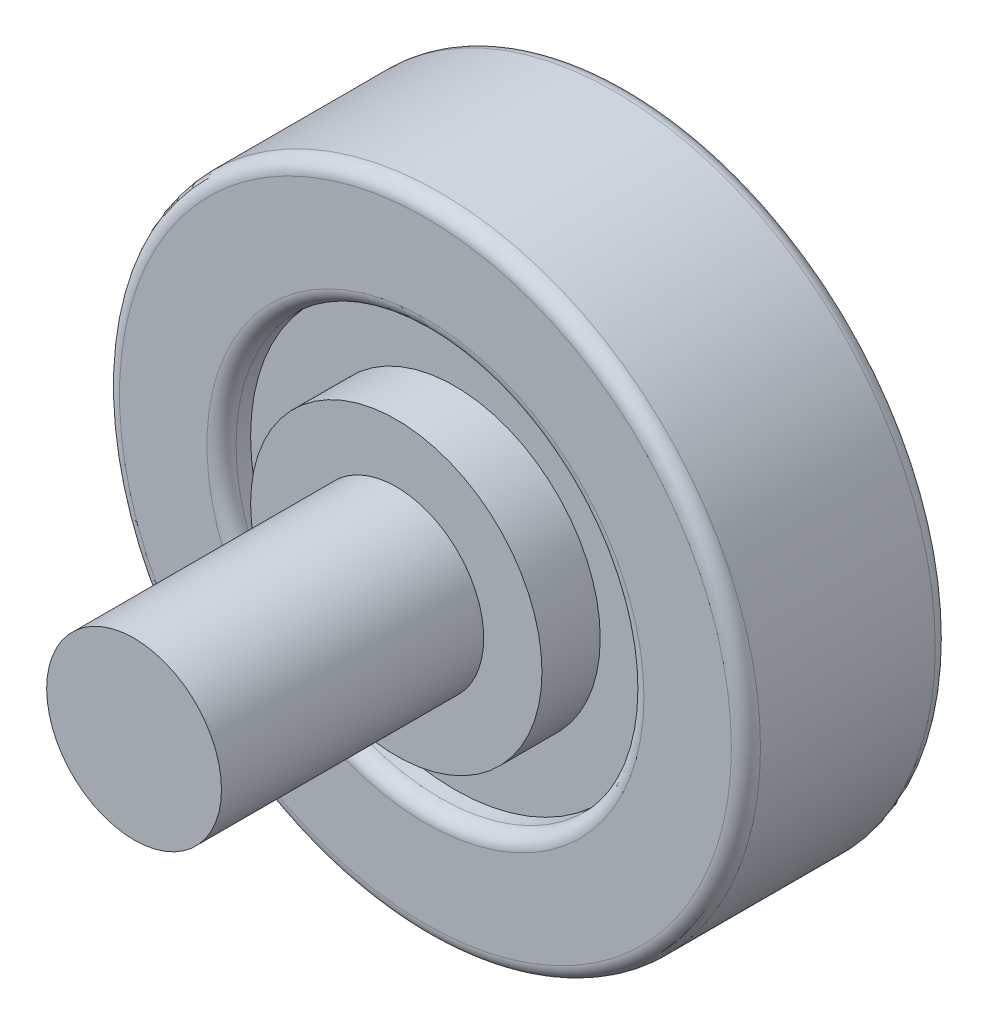
from build123d import *

# Parameters (mm, degrees)
SKETCH_1_R              = 11
SKETCH_1_R_2            = 2.5
EXTRUDE_1_DEPTH         = 3.5
SKETCH_2_R              = 7
CUT_EXTRUDE_1_DEPTH     = 1
SHEET_EXTRUDE_1_1_BACK  = 14
SHEET_EXTRUDE_1_1_DEPTH = 14
SHEET_EXTRUDE_1_2_BACK  = 14
SHEET_EXTRUDE_1_2_DEPTH = 14
FILLET_1_R              = 0.5
SKETCH_5_R              = 3
EXTRUDE_3_DEPTH         = 16
SKETCH_6_R              = 5
EXTRUDE_4_DEPTH         = 2


with BuildPart() as part:
    # 草图1 → 凸台-拉伸1 (new, symmetric)
    with BuildSketch(Plane.XY):
        Circle(SKETCH_1_R)
        Circle(SKETCH_1_R_2, mode=Mode.SUBTRACT)
    extrude(amount=EXTRUDE_1_DEPTH, both=True)

    # 草图2 → 切除-拉伸1 (cut)
    with BuildSketch(Plane.XY.offset(3.5)):
        Circle(SKETCH_2_R)
    cut_extrude_1 = extrude(amount=-CUT_EXTRUDE_1_DEPTH, mode=Mode.SUBTRACT)

    # 镜向1: 切除-拉伸1 across plane
    add(cut_extrude_1.mirror(Plane.XY), mode=Mode.SUBTRACT)


with BuildPart() as body_2:
    # Split Bodies 1: the piece behind the surface
    add(part.part)
    # Sheet 凸台-拉伸1: a surface, the sketch's curves swept straight by 14 mm
    with BuildLine(Plane(origin=(0, 0, -2.5), x_dir=(-1, 0, 0), z_dir=(0, 0, -1)).offset(-SHEET_EXTRUDE_1_1_BACK), mode=Mode.PRIVATE) as sheet_extrude_1_1_path:
        CenterArc((0, 0), 7, 0, 360)
    sheet_extrude_1_1 = Shell.extrude(sheet_extrude_1_1_path.wire(), (0 * SHEET_EXTRUDE_1_1_DEPTH, 0 * SHEET_EXTRUDE_1_1_DEPTH, -1 * SHEET_EXTRUDE_1_1_DEPTH))
    split(bisect_by=sheet_extrude_1_1, keep=Keep.BOTTOM)

    # 圆角1
    fillet_1_edges = [body_2.edges().sort_by_distance(p)[0] for p in [
        (-7, 0, -3.5),
        (0, 7, 3.5),
        (-11, 0, -3.5),
        (-11, 0, 3.5),
    ]]
    fillet(fillet_1_edges, radius=FILLET_1_R)


with BuildPart() as part_1:
    add(part.part)

    # Split Bodies 1: split by a surface, the side it looks to stays
    # Sheet 凸台-拉伸1: a surface, the sketch's curves swept straight by 14 mm
    with BuildLine(Plane(origin=(0, 0, -2.5), x_dir=(-1, 0, 0), z_dir=(0, 0, -1)).offset(-SHEET_EXTRUDE_1_2_BACK), mode=Mode.PRIVATE) as sheet_extrude_1_2_path:
        CenterArc((0, 0), 7, 0, 360)
    sheet_extrude_1_2 = Shell.extrude(sheet_extrude_1_2_path.wire(), (0 * SHEET_EXTRUDE_1_2_DEPTH, 0 * SHEET_EXTRUDE_1_2_DEPTH, -1 * SHEET_EXTRUDE_1_2_DEPTH))
    split(bisect_by=sheet_extrude_1_2, keep=Keep.TOP)


with BuildPart() as body_3:
    # 草图5 → 凸台-拉伸3 (new body)
    with BuildSketch(Plane(origin=(0, 0, -2.5), x_dir=(-1, 0, 0), z_dir=(0, 0, -1))):
        Circle(SKETCH_5_R)
    extrude(amount=-EXTRUDE_3_DEPTH)


with BuildPart() as body_4:
    # 草图6 → 凸台-拉伸4 (new body)
    with BuildSketch(Plane.XY.offset(2.5)):
        Circle(SKETCH_6_R)
    extrude(amount=EXTRUDE_4_DEPTH)


solid = Compound([body_2.part, part_1.part, body_3.part, body_4.part])
